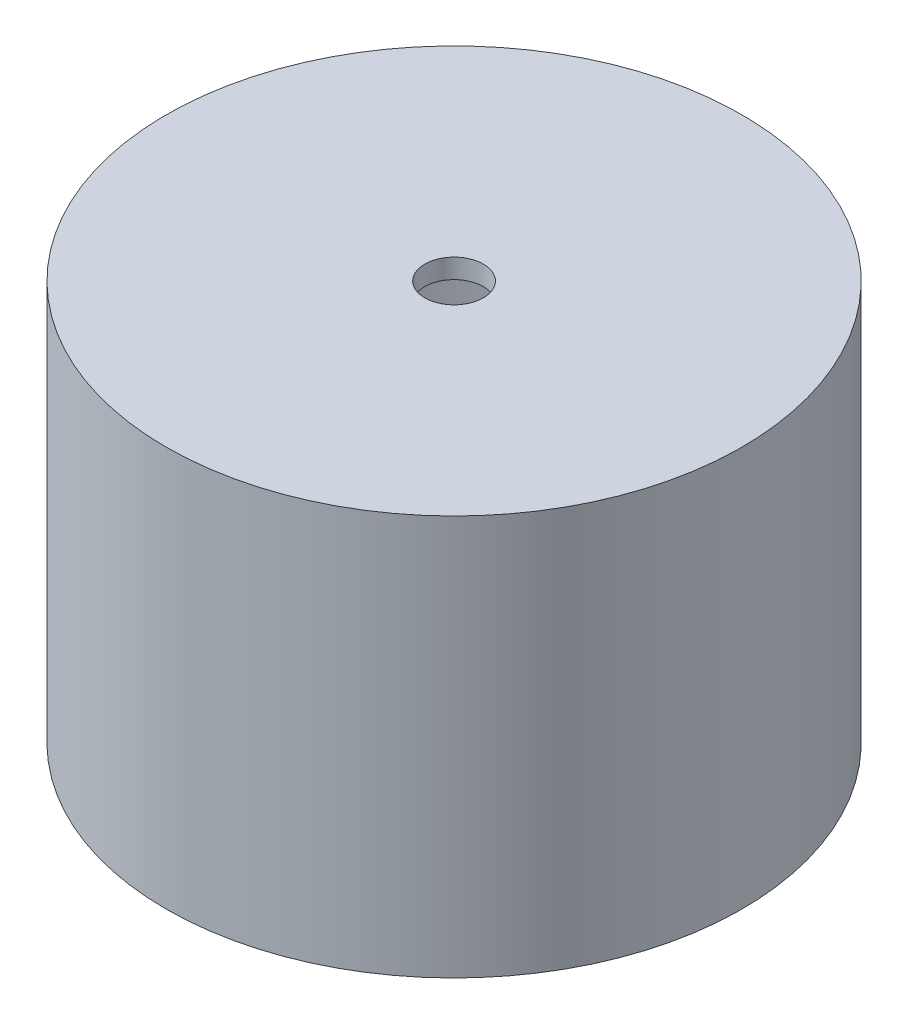
from build123d import *

# Parameters (mm, degrees)
SKETCH1_R           = 37.465
SKETCH1_R_2         = 3.81
BOSS_EXTRUDE1_DEPTH = 2.54
SKETCH2_R           = 9.39
SKETCH2_R_2         = 5.58
BOSS_EXTRUDE2_DEPTH = 50.8
SKETCH3_R           = 37.465
SKETCH3_R_2         = 36.165
BOSS_EXTRUDE3_DEPTH = 49.53
SKETCH5_R           = 5.58
BOSS_EXTRUDE4_DEPTH = 41.91


with BuildPart() as part:
    # Sketch1 → Boss-Extrude1 (new body)
    with BuildSketch(Plane(origin=(0, 0, 0), x_dir=(1, 0, 0), z_dir=(0, 1, 0))):
        with Locations(Location((0, 0, 0), (0, 0, 270))):
            Circle(SKETCH1_R)
        with Locations(Location((0, 0, 0), (0, 0, 270))):
            Circle(SKETCH1_R_2, mode=Mode.SUBTRACT)
    extrude(amount=-BOSS_EXTRUDE1_DEPTH)

    # Sketch2 → Boss-Extrude2 (add)
    # profile 1 of 2: a face of its own
    with BuildSketch(Plane.XZ.offset(2.54)):
        with Locations(Location((0, 18.7325, 0), (0, 0, 90))):
            Circle(SKETCH2_R)
        with Locations(Location((0, 18.7325, 0), (0, 0, 270))):
            Circle(SKETCH2_R_2, mode=Mode.SUBTRACT)
    # profile 2 of 2: a face of its own
    with BuildSketch(Plane.XZ.offset(2.54)):
        with Locations(Location((0, -18.7325, 0), (0, 0, 90))):
            Circle(SKETCH2_R)
        with Locations(Location((0, -18.7325, 0), (0, 0, 90))):
            Circle(SKETCH2_R_2, mode=Mode.SUBTRACT)
    extrude(amount=BOSS_EXTRUDE2_DEPTH)

    # Sketch3 → Boss-Extrude3 (add)
    with BuildSketch(Plane.XZ.offset(2.54)):
        with Locations(Location((0, 0, 0), (0, 0, 90))):
            Circle(SKETCH3_R)
        with Locations(Location((0, 0, 0), (0, 0, 90))):
            Circle(SKETCH3_R_2, mode=Mode.SUBTRACT)
    extrude(amount=BOSS_EXTRUDE3_DEPTH)

    # Sketch5 → Boss-Extrude4 (add)
    with BuildSketch(Plane.XZ.offset(2.54)):
        with Locations(Location((0, 18.7325, 0), (0, 0, 270))):
            Circle(SKETCH5_R)
        with Locations(Location((0, -18.7325, 0), (0, 0, 90))):
            Circle(SKETCH5_R)
    extrude(amount=BOSS_EXTRUDE4_DEPTH)


solid = part.part
